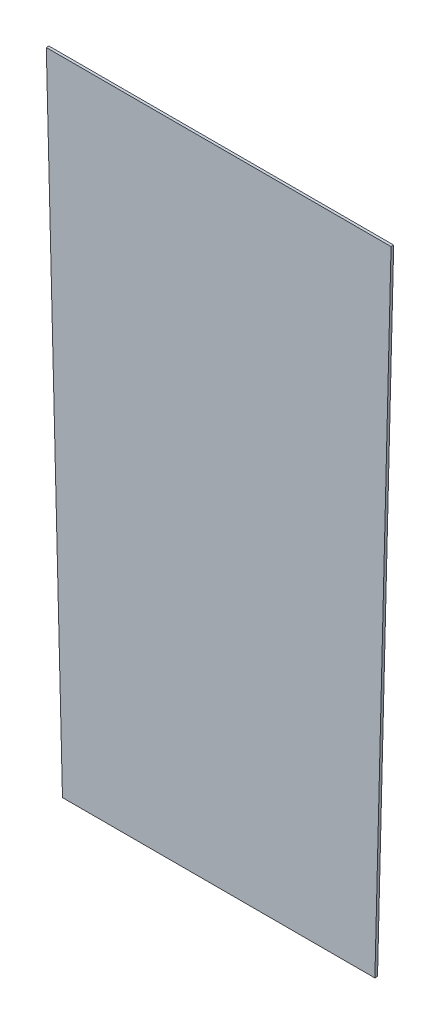
from build123d import *

# Parameters (mm, degrees)
BOSS_EXTRUDE1_DEPTH = 3.6


with BuildPart() as part:
    # Sketch1 → Boss-Extrude1 (new body)
    with BuildSketch(Plane.XY):
        Polygon((78.918285953, 45.719027647), (506.418285953, 45.719027647), (528.548285953, 923.589027647), (56.788285953, 923.589027647), align=None)
    extrude(amount=BOSS_EXTRUDE1_DEPTH)


solid = part.part
